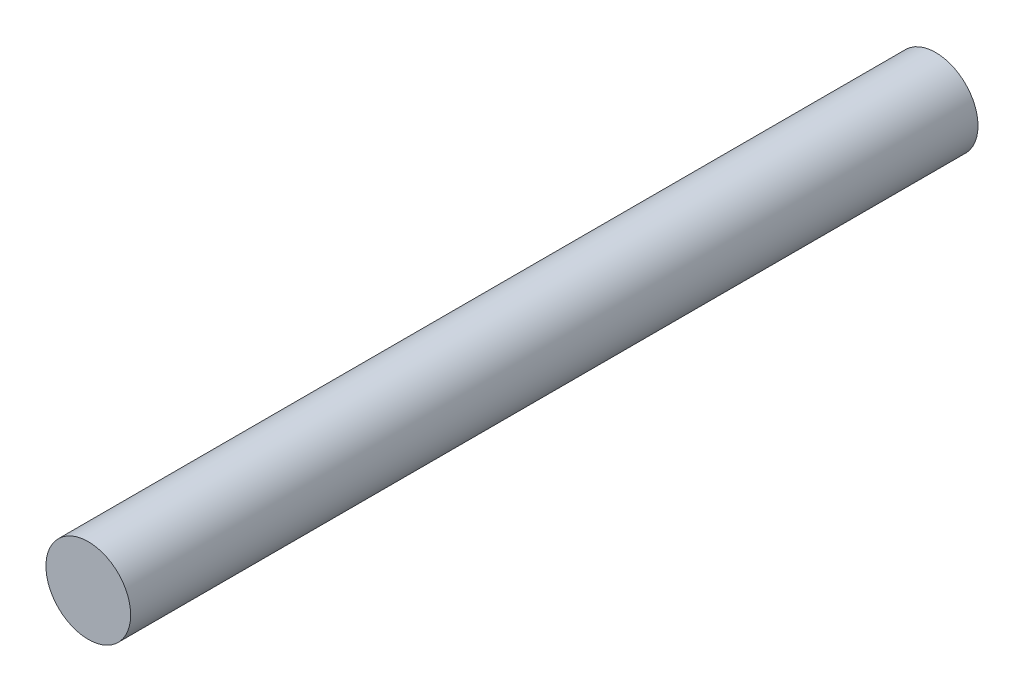
from build123d import *

# Parameters (mm, degrees)
SKETCH1_R           = 10
BOSS_EXTRUDE1_DEPTH = 100


with BuildPart() as part:
    # Sketch1 → Boss-Extrude1 (new, symmetric)
    with BuildSketch(Plane.XY):
        Circle(SKETCH1_R)
    extrude(amount=BOSS_EXTRUDE1_DEPTH, both=True)


solid = part.part
